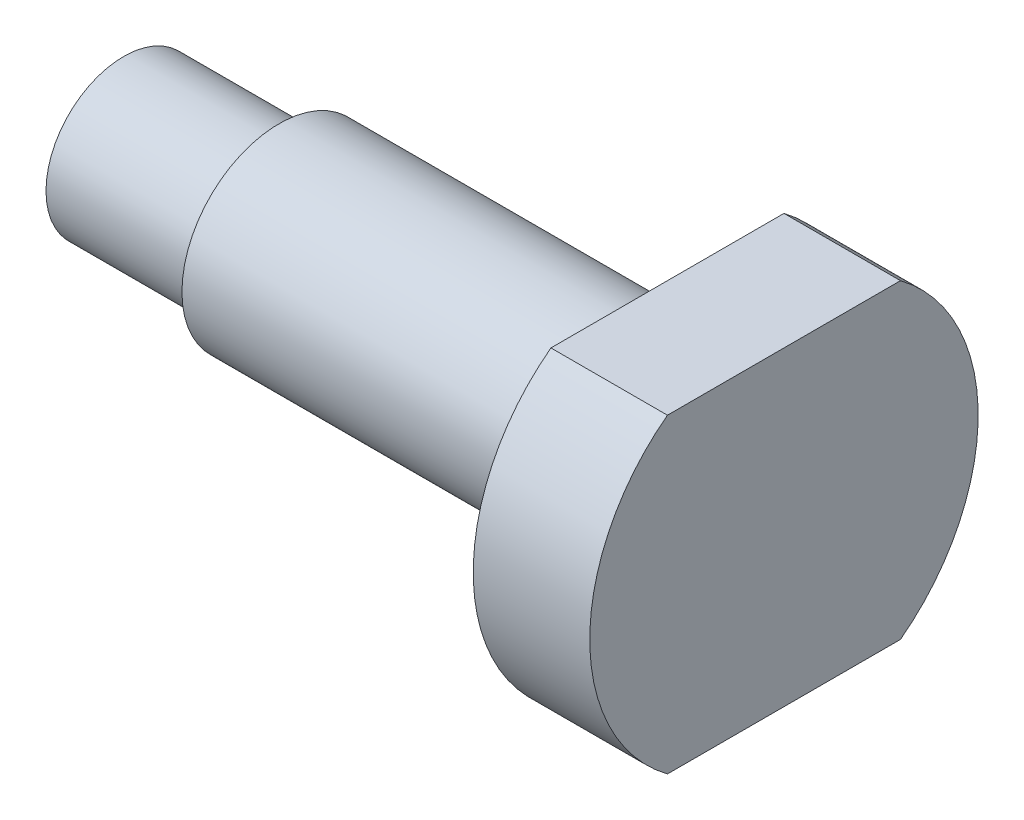
from build123d import *

# Parameters (mm, degrees)
BOSS_EXTRUDE1_DEPTH = 3
SKETCH2_3_R         = 2.5
BOSS_EXTRUDE2_DEPTH = 10
SKETCH3_R           = 2
BOSS_EXTRUDE3_DEPTH = 4


with BuildPart() as part:
    # Sketch2 → Boss-Extrude1 (new body)
    with BuildSketch(Plane(origin=(0, 0, 0), x_dir=(0, 0, -1), z_dir=(1, 0, 0))):
        with BuildLine():
            ThreePointArc((3, -4), (5, 0), (3, 4))
            Line((3, 4), (-3, 4))
            ThreePointArc((-3, 4), (-5, 0), (-3, -4))
            Line((-3, -4), (3, -4))
        make_face()
    extrude(amount=BOSS_EXTRUDE1_DEPTH)

    # Sketch2<3> → Boss-Extrude2 (add)
    with BuildSketch(Plane(origin=(0, 0, 0), x_dir=(0, 0, -1), z_dir=(1, 0, 0))):
        Circle(SKETCH2_3_R)
    extrude(amount=-BOSS_EXTRUDE2_DEPTH)

    # Sketch3 → Boss-Extrude3 (add)
    with BuildSketch(Plane.ZY.offset(10)):
        Circle(SKETCH3_R)
    extrude(amount=BOSS_EXTRUDE3_DEPTH)


solid = part.part
